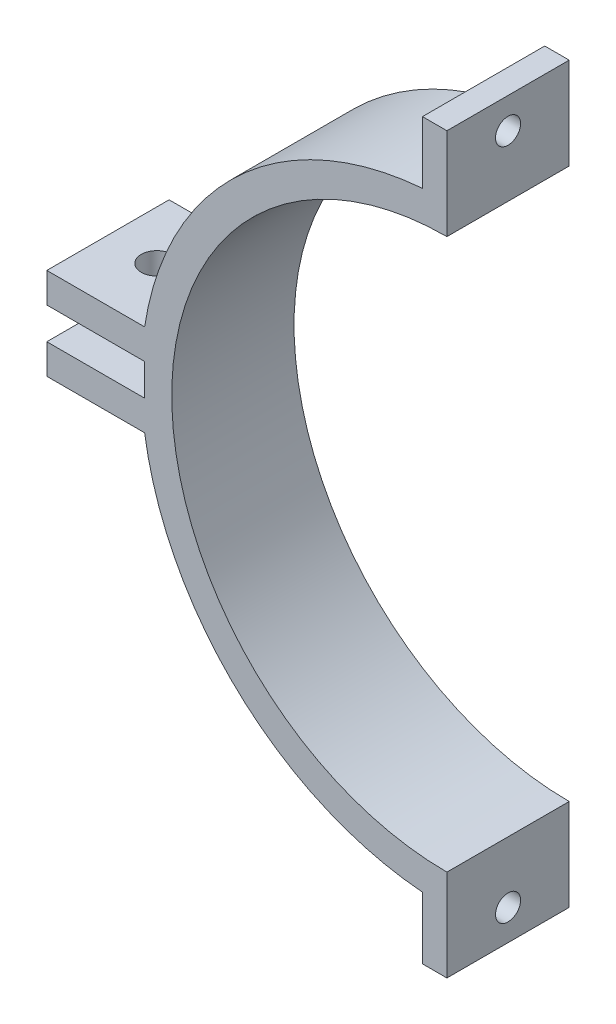
from build123d import *

# Parameters (mm, degrees)
BOSS_EXTRUDE1_DEPTH = 20
CUT_EXTRUDE1_REACH  = 90.171
SKETCH2_R           = 2.05
SKETCH3_W           = 20
SKETCH3_H           = 5.2
CUT_EXTRUDE2_DEPTH  = 16
SKETCH4_R           = 2.55
CUT_EXTRUDE3_DEPTH  = 97.113982306


with BuildPart() as part:
    # Sketch1 → Boss-Extrude1 (new body)
    with BuildSketch(Plane.XY):
        with BuildLine():
            ThreePointArc((0, -45), (-45, 0), (0, 45))
            Line((0, 45), (0, 60))
            Line((0, 60), (-4, 60))
            Line((-4, 60), (-4, 49.839743178))
            ThreePointArc((-4, 49.839743178), (-34.087674646, 36.579098366), (-49.434299833, 7.5))
            Line((-49.434299833, 7.5), (-65.434299833, 7.5))
            Line((-65.434299833, 7.5), (-65.434299833, -7.5))
            Line((-65.434299833, -7.5), (-49.434299833, -7.5))
            ThreePointArc((-49.434299833, -7.5), (-34.087674646, -36.579098366), (-4, -49.839743178))
            Line((-4, -49.839743178), (-4, -60))
            Line((-4, -60), (0, -60))
            Line((0, -60), (0, -45))
        make_face()
    extrude(amount=BOSS_EXTRUDE1_DEPTH)

    # Sketch2 → Cut-Extrude1 (cut, up to next)
    with BuildSketch(Plane.ZY.offset(4), mode=Mode.PRIVATE) as cut_extrude1_sk1:
        with Locations(Location((10, 55, 0), (0, 0, 270))):
            Circle(SKETCH2_R)
    cut_extrude1_tool1 = extrude(cut_extrude1_sk1.sketch, amount=-CUT_EXTRUDE1_REACH, mode=Mode.PRIVATE) & part.part
    cut_extrude1 = cut_extrude1_tool1.solids().sort_by_distance((-4, 55, 10))[0]
    add(cut_extrude1, mode=Mode.SUBTRACT)

    # Mirror1: Cut-Extrude1 across plane
    add(cut_extrude1.mirror(Plane.ZX), mode=Mode.SUBTRACT)

    # Sketch3 → Cut-Extrude2 (cut)
    with BuildSketch(Plane.ZY.offset(65.434299833)):
        with Locations((10, 0)):
            Rectangle(SKETCH3_W, SKETCH3_H)
    extrude(amount=-CUT_EXTRUDE2_DEPTH, mode=Mode.SUBTRACT)

    # Sketch4 → Cut-Extrude3 (cut, through all)
    with BuildSketch(Plane(origin=(0, 7.5, 0), x_dir=(1, 0, 0), z_dir=(0, 1, 0))):
        with Locations(Location((-57.434299833, -10, 0), (0, 0, 90))):
            Circle(SKETCH4_R)
    extrude(amount=-CUT_EXTRUDE3_DEPTH, mode=Mode.SUBTRACT)


solid = part.part
